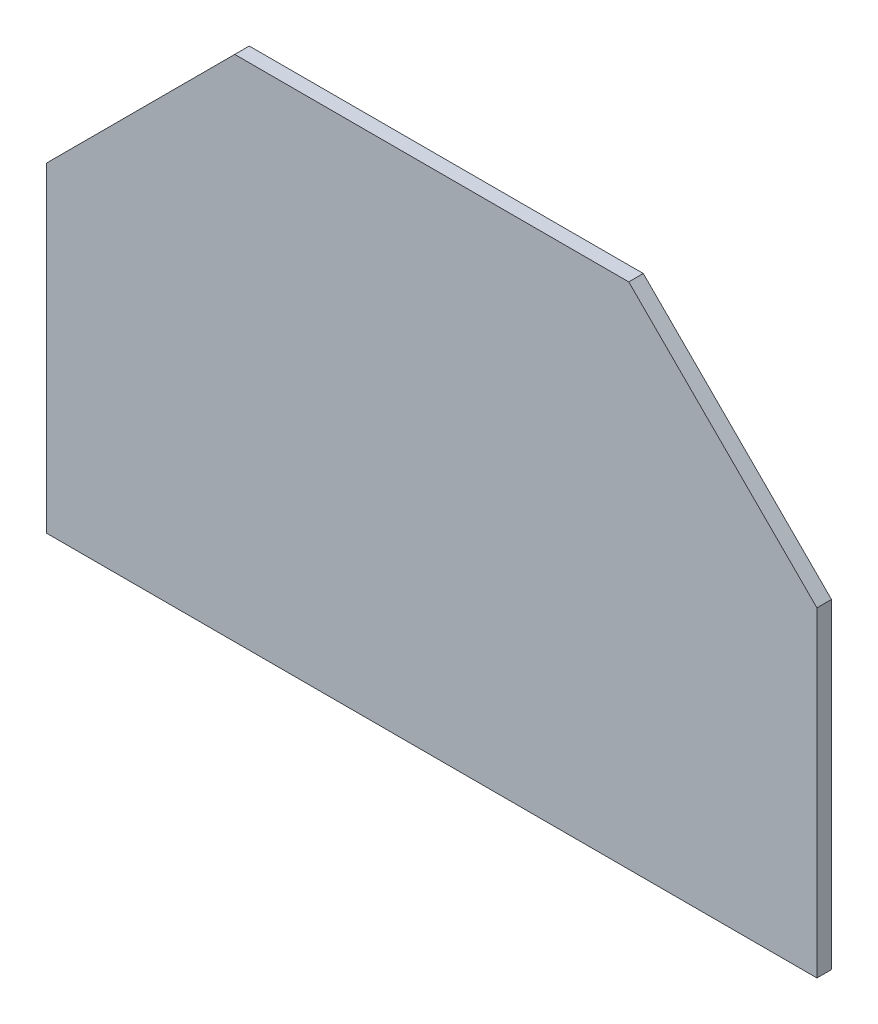
from build123d import *

# Parameters (mm, degrees)
BOSS_EXTRUDE1_DEPTH = 5.08


with BuildPart() as part:
    # Sketch1 → Boss-Extrude1 (new body)
    with BuildSketch(Plane.XY):
        Polygon((134.62, 23.133576682), (68.853576682, 88.9), (-68.853576682, 88.9), (-134.62, 23.133576682), (-134.62, -88.9), (134.62, -88.9), align=None)
    extrude(amount=BOSS_EXTRUDE1_DEPTH)


solid = part.part
